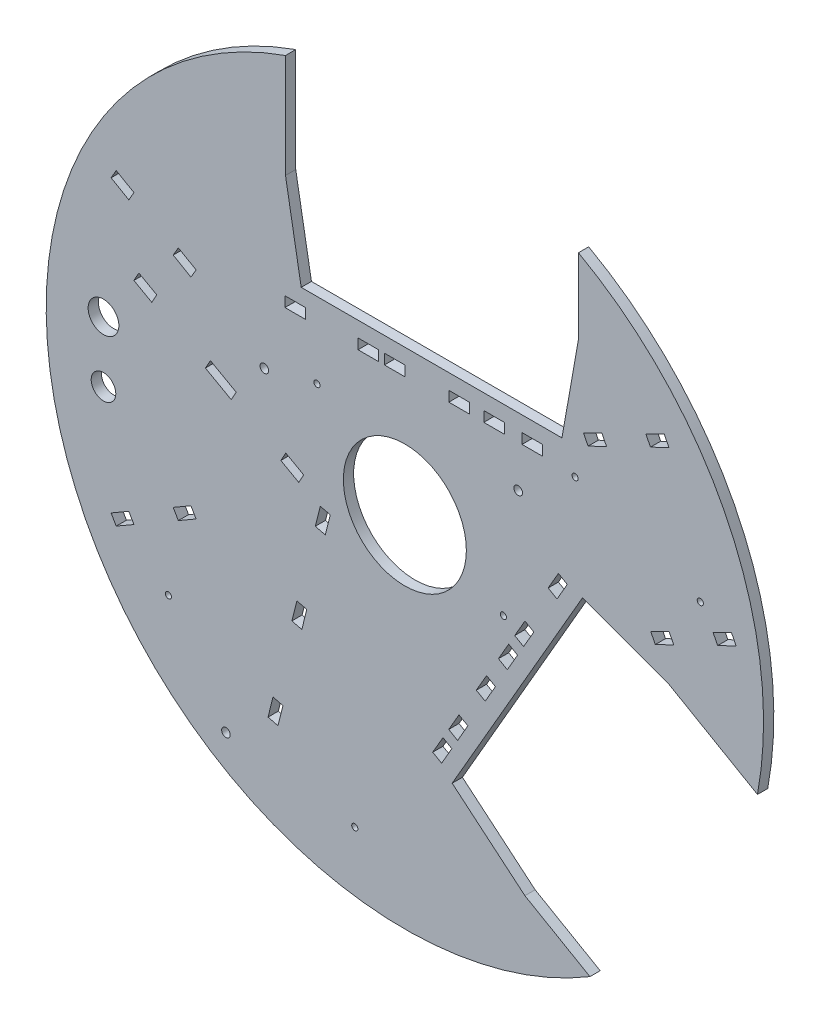
from build123d import *

# Parameters (mm, degrees)
ESQUISSE1_R             = 175
BOSS_EXTRU_1_DEPTH      = 5
ENL_V_MAT_EXTRU_1_DEPTH = 5
ESQUISSE3_W             = 10
ESQUISSE3_H             = 5
ENL_V_MAT_EXTRU_2_DEPTH = 10
ESQUISSE4_R             = 1.5
ENL_V_MAT_EXTRU_3_DEPTH = 10
ENL_V_MAT_EXTRU_4_DEPTH = 10
ESQUISSE6_W             = 10
ESQUISSE6_H             = 5
ENL_V_MAT_EXTRU_5_DEPTH = 5
TROU_TARAUD_M51_D       = 4.2
ESQUISSE10_R            = 30
ESQUISSE10_R_2          = 6
ESQUISSE10_R_3          = 7.5
ENL_V_MAT_EXTRU_6_DEPTH = 5
ESQUISSE11_R            = 1.5
ENL_V_MAT_EXTRU_7_DEPTH = 10


with BuildPart() as part:
    # Esquisse1 → Boss.-Extru.1 (new body)
    with BuildSketch(Plane.XY):
        Circle(ESQUISSE1_R)
    extrude(amount=BOSS_EXTRU_1_DEPTH)

    # Esquisse2 → Enlèv. mat.-Extru.1 (cut)
    with BuildSketch(Plane(origin=(0, 0, 0), x_dir=(-1, 0, 0), z_dir=(0, 0, -1))):
        Polygon((58.240826849, 114.332025077), (58.240826849, 213.87663255), (-84.681680643, 213.87663255), (-84.681680643, 116.513512453), (-76.636603499, 70.887612711), (50.580404788, 70.887612711), align=None)
        Polygon((-128.134851608, -6.727976949), (-214.343010489, -56.500280686), (-142.881756743, -180.274802947), (-58.562821347, -131.593242898), (-23.072171671, -101.813051845), (-86.680675815, 8.360109125), align=None)
    extrude(amount=-ENL_V_MAT_EXTRU_1_DEPTH, mode=Mode.SUBTRACT)

    # Esquisse3 → Enlèv. mat.-Extru.2 (cut)
    with BuildSketch(Plane.XY.offset(5)):
        Polygon((-49.356660547, -7.757843325), (-58.077491782, -2.864265639), (-60.524280625, -7.224681256), (-51.803449391, -12.118258943), align=None)
        Polygon((-82.29909118, 10.727360567), (-94.870678761, 17.781738621), (-97.317467605, 13.421323004), (-84.745880023, 6.36694495), align=None)
        Polygon((-121.033172465, 32.462471681), (-129.7540037, 37.356049368), (-132.200792544, 32.995633751), (-123.479961309, 28.102056064), align=None)
        Polygon((-36.411918308, -18.139201989), (-38.839769225, -27.840002983), (-43.690169722, -26.626077525), (-41.262318805, -16.925276531), align=None)
        Polygon((-47.8486979, -63.836374764), (-50.276548817, -73.537175758), (-55.126949314, -72.323250299), (-52.699098397, -62.622449305), align=None)
        Polygon((-59.476502021, -110.296811432), (-61.904352938, -119.997612426), (-66.754753435, -118.783686967), (-64.326902518, -109.082885973), align=None)
        Polygon((62.914433511, -18.00423005), (58.584306492, -15.50423005), (53.584306492, -24.164484088), (57.914433511, -26.664484088), align=None)
        Polygon((39.851125271, -47.951051713), (44.18125229, -50.451051713), (39.18125229, -59.11130575), (34.851125271, -56.61130575), align=None)
        Polygon((18.584306492, -84.786262353), (22.914433511, -87.286262353), (17.914433511, -95.946516391), (13.584306492, -93.446516391), align=None)
        with Locations((62.155135581, 60.887612711)):
            Rectangle(ESQUISSE3_W, ESQUISSE3_H)
        with Locations((-17.844864419, 60.887612711)):
            Rectangle(ESQUISSE3_W, ESQUISSE3_H)
        with Locations((26.44406925, 60.887612711)):
            Rectangle(ESQUISSE3_W, ESQUISSE3_H)
        Polygon((122.148385312, 6.310171572), (119.963600629, 10.807583704), (128.958424895, 15.177153069), (131.143209577, 10.679740937), align=None)
        Polygon((159.379066535, 29.955107573), (150.38424227, 25.585538209), (152.569026952, 21.088126076), (161.563851217, 25.457695441), align=None)
        Polygon((126.607296299, 97.416289564), (117.612472034, 93.046720199), (119.797256716, 88.549308067), (128.792080981, 92.918877432), align=None)
        Polygon((96.186654659, 82.63833506), (98.371439341, 78.140922927), (89.376615076, 73.771353563), (87.191830393, 78.268765695), align=None)
    extrude(amount=-ENL_V_MAT_EXTRU_2_DEPTH, mode=Mode.SUBTRACT)

    # Esquisse4 → Enlèv. mat.-Extru.3 (cut)
    with BuildSketch(Plane(origin=(0, 0, 0), x_dir=(-1, 0, 0), z_dir=(0, 0, -1))):
        with Locations((115.362702052, -91.589286674)):
            Circle(ESQUISSE4_R)
        with Locations((24.430034655, -144.089286674)):
            Circle(ESQUISSE4_R)
        with Locations((-48.069965345, -18.515603125)):
            Circle(ESQUISSE4_R)
        with Locations((42.862702052, 33.984396875)):
            Circle(ESQUISSE4_R)
    extrude(amount=-ENL_V_MAT_EXTRU_3_DEPTH, mode=Mode.SUBTRACT)

    # Esquisse5 → Enlèv. mat.-Extru.4 (cut)
    with BuildSketch(Plane(origin=(0, 0, 0), x_dir=(-1, 0, 0), z_dir=(0, 0, -1))):
        Polygon((132.178427666, -70.125229259), (134.678427666, -65.79510224), (143.338681704, -70.79510224), (140.838681704, -75.125229259), align=None)
        Polygon((110.527792572, -57.625229259), (113.027792572, -53.29510224), (104.367538534, -48.29510224), (101.867538534, -52.625229259), align=None)
        Polygon((134.678427666, 65.79510224), (132.178427666, 70.125229259), (140.838681704, 75.125229259), (143.338681704, 70.79510224), align=None)
        Polygon((110.527792572, 57.625229259), (113.027792572, 53.29510224), (104.367538534, 48.29510224), (101.867538534, 52.625229259), align=None)
    extrude(amount=-ENL_V_MAT_EXTRU_4_DEPTH, mode=Mode.SUBTRACT)

    # Esquisse6 → Enlèv. mat.-Extru.5 (cut)
    with BuildSketch(Plane.XY.offset(5)):
        Polygon((25.731885433, -82.406292477), (30.731885433, -73.746038439), (26.401758414, -71.246038439), (21.401758414, -79.906292477), align=None)
        Polygon((49.981885433, -40.404060393), (54.981885433, -31.743806355), (50.651758414, -29.243806355), (45.651758414, -37.904060393), align=None)
        with Locations((43.5, 60.887612711)):
            Rectangle(ESQUISSE6_W, ESQUISSE6_H)
        Polygon((74.901758414, 12.758425728), (69.901758414, 4.09817169), (74.231885433, 1.59817169), (79.231885433, 10.258425728), align=None)
        with Locations((-5, 60.887612711)):
            Rectangle(ESQUISSE6_W, ESQUISSE6_H)
        with Locations((-53.5, 60.887612711)):
            Rectangle(ESQUISSE6_W, ESQUISSE6_H)
    extrude(amount=-ENL_V_MAT_EXTRU_5_DEPTH, mode=Mode.SUBTRACT)

    # Trou taraudé M51 (through all)
    with Locations(Plane(origin=(0, 0, -85), x_dir=(1, 0, 0), z_dir=(0, 0, -1))):
        with Locations((-68.568956805, -27.662548456), (55.280905682, -37.98337033), (-87.299337242, 135.559338217)):
            Hole(TROU_TARAUD_M51_D / 2)

    # Esquisse10 → Enlèv. mat.-Extru.6 (cut)
    with BuildSketch(Plane.XY.offset(5)):
        Circle(ESQUISSE10_R)
        with Locations((-147.042149298, -19.335087814)):
            Circle(ESQUISSE10_R_2)
        with Locations((-147.042149298, 10.187091802)):
            Circle(ESQUISSE10_R_3)
    extrude(amount=-ENL_V_MAT_EXTRU_6_DEPTH, mode=Mode.SUBTRACT)

    # Esquisse11 → Enlèv. mat.-Extru.7 (cut)
    with BuildSketch(Plane(origin=(0, 0, 0), x_dir=(-1, 0, 0), z_dir=(0, 0, -1))):
        with Locations((-144.123215362, 35.340734311)):
            Circle(ESQUISSE11_R)
        with Locations((-83.043195011, 57.572043627)):
            Circle(ESQUISSE11_R)
    extrude(amount=-ENL_V_MAT_EXTRU_7_DEPTH, mode=Mode.SUBTRACT)


solid = part.part
